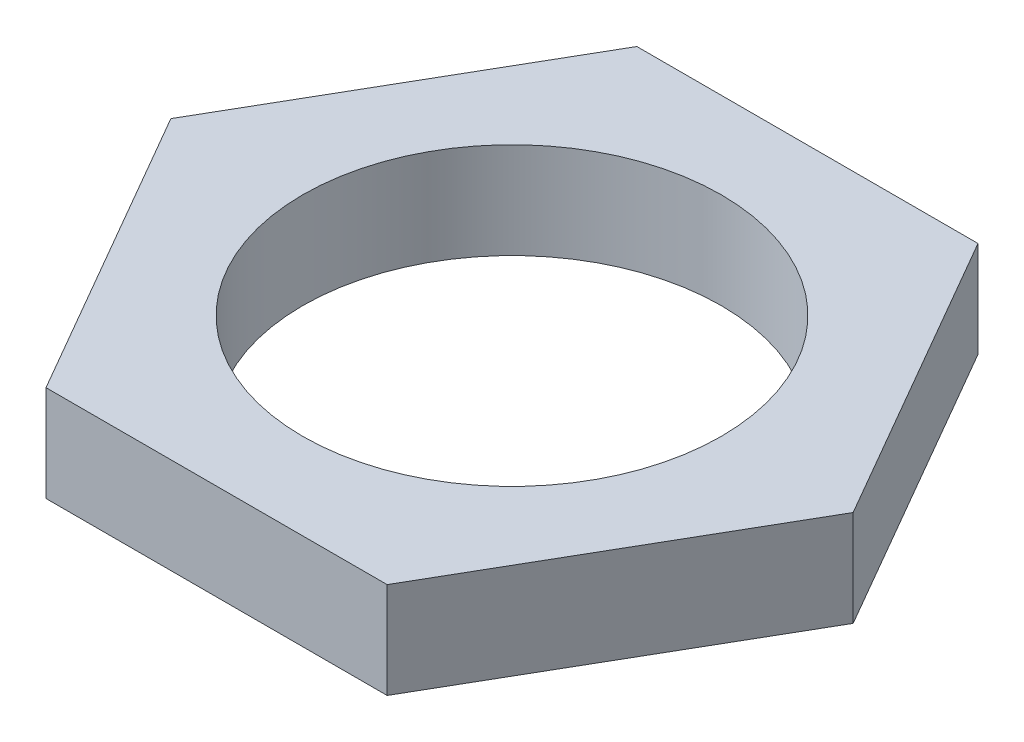
from build123d import *

# Parameters (mm, degrees)
SKETCH2_R           = 8.5
BOSS_EXTRUDE1_DEPTH = 3.9


with BuildPart() as part:
    # Sketch2 → Boss-Extrude1 (new body)
    with BuildSketch(Plane(origin=(0, 0, 0), x_dir=(1, 0, 0), z_dir=(0, 1, 0))):
        Polygon((6.92820323, 12), (-6.92820323, 12), (-13.856406461, 0), (-6.92820323, -12), (6.92820323, -12), (13.856406461, 0), align=None)
        with Locations(Location((0, 0, 0), (0, 0, 270))):
            Circle(SKETCH2_R, mode=Mode.SUBTRACT)
    extrude(amount=BOSS_EXTRUDE1_DEPTH)


solid = part.part
